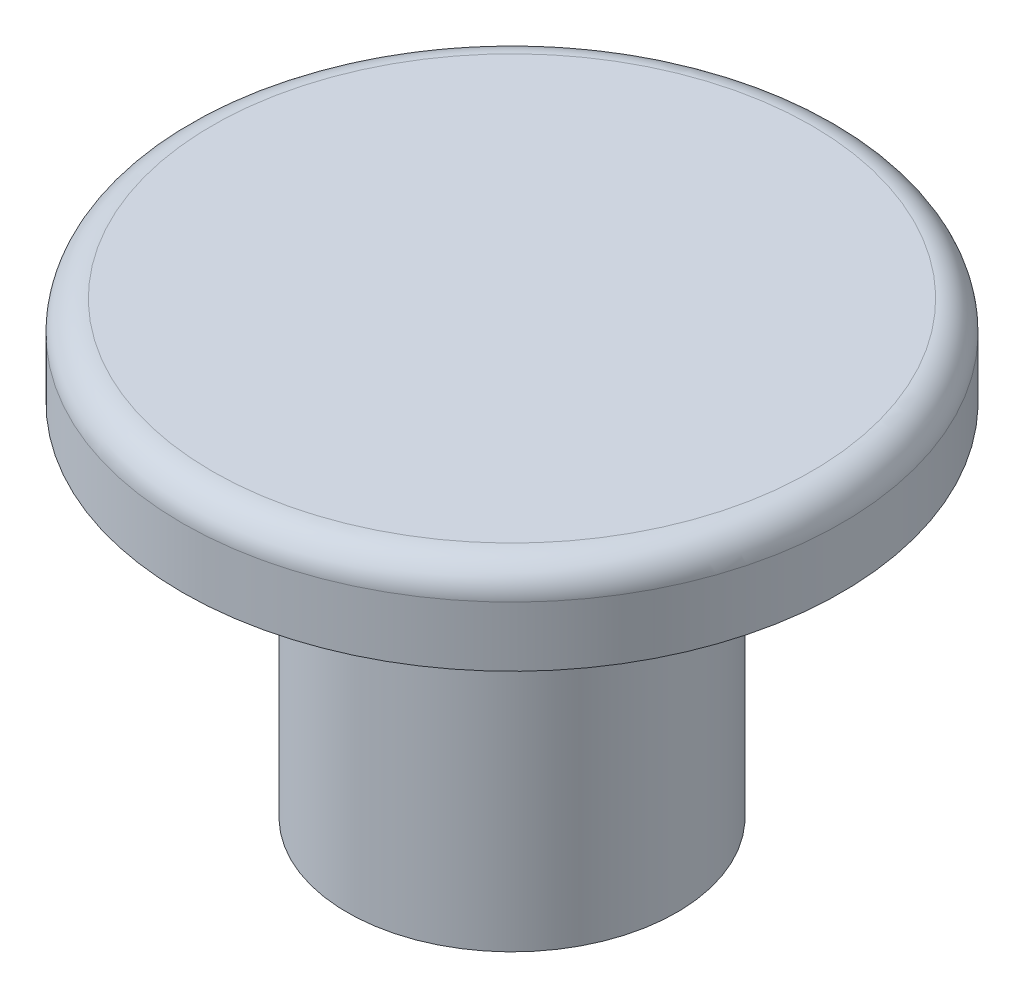
from build123d import *

# Parameters (mm, degrees)
SKETCH1_R           = 11
BOSS_EXTRUDE1_DEPTH = 3
SKETCH2_R           = 5.5
BOSS_EXTRUDE2_DEPTH = 12
FILLET1_R           = 1


with BuildPart() as part:
    # Sketch1 → Boss-Extrude1 (new body)
    with BuildSketch(Plane(origin=(0, 0, 0), x_dir=(1, 0, 0), z_dir=(0, 1, 0))):
        with Locations(Location((0, 0, 0), (0, 0, 270))):
            Circle(SKETCH1_R)
    extrude(amount=BOSS_EXTRUDE1_DEPTH)

    # Sketch2 → Boss-Extrude2 (add)
    with BuildSketch(Plane.XZ):
        with Locations(Location((0, 0, 0), (0, 0, 270))):
            Circle(SKETCH2_R)
    extrude(amount=BOSS_EXTRUDE2_DEPTH)

    # Fillet1
    fillet1_edges = [part.edges().sort_by_distance(p)[0] for p in [
        (0, 3, -11),
    ]]
    fillet(fillet1_edges, radius=FILLET1_R)


solid = part.part
